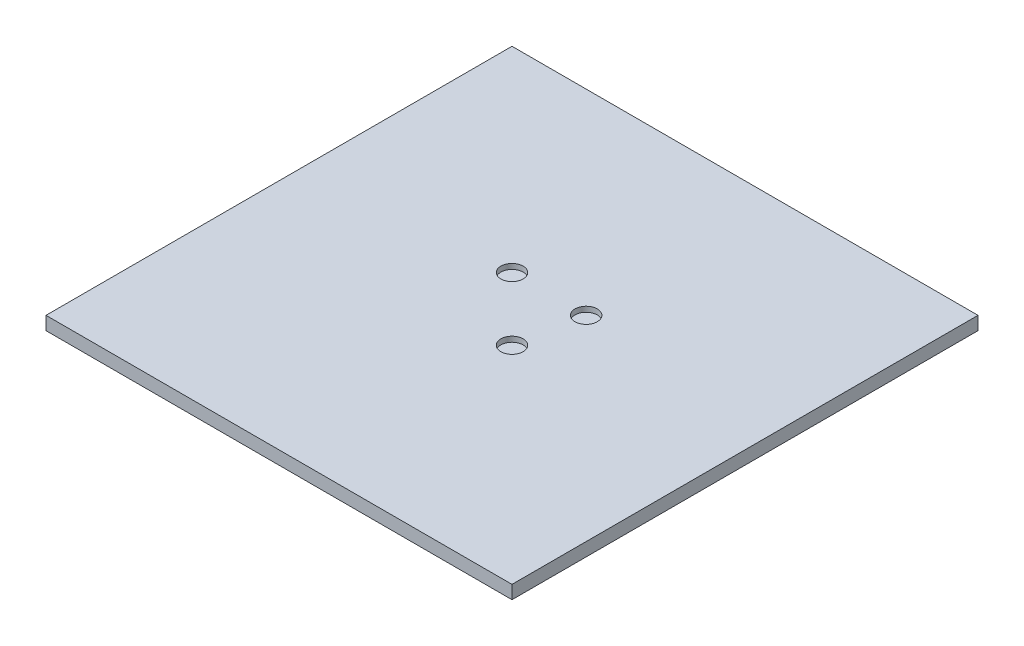
from build123d import *

# Parameters (mm, degrees)
SKETCH1_W           = 88.9
SKETCH1_H           = 88.9
BOSS_EXTRUDE1_DEPTH = 2.54
SKETCH3_R           = 2.125
CUT_EXTRUDE1_DEPTH  = 1


with BuildPart() as part:
    # Sketch1 → Boss-Extrude1 (new body)
    with BuildSketch(Plane(origin=(0, 0, 0), x_dir=(1, 0, 0), z_dir=(0, 1, 0))):
        Rectangle(SKETCH1_W, SKETCH1_H)
    extrude(amount=BOSS_EXTRUDE1_DEPTH)

    # Sketch3 → Cut-Extrude1 (cut)
    with BuildSketch(Plane(origin=(0, 2.54, 0), x_dir=(1, 0, 0), z_dir=(0, 1, 0))):
        with Locations(Location((-7.071067812, 7.071067812, 0), (0, 0, 270))):
            Circle(SKETCH3_R)
        with Locations(Location((7.071067812, 7.071067812, 0), (0, 0, 270))):
            Circle(SKETCH3_R)
        with Locations(Location((4.949747468, -4.949747468, 0), (0, 0, 270))):
            Circle(SKETCH3_R)
    extrude(amount=-CUT_EXTRUDE1_DEPTH, mode=Mode.SUBTRACT)


solid = part.part
